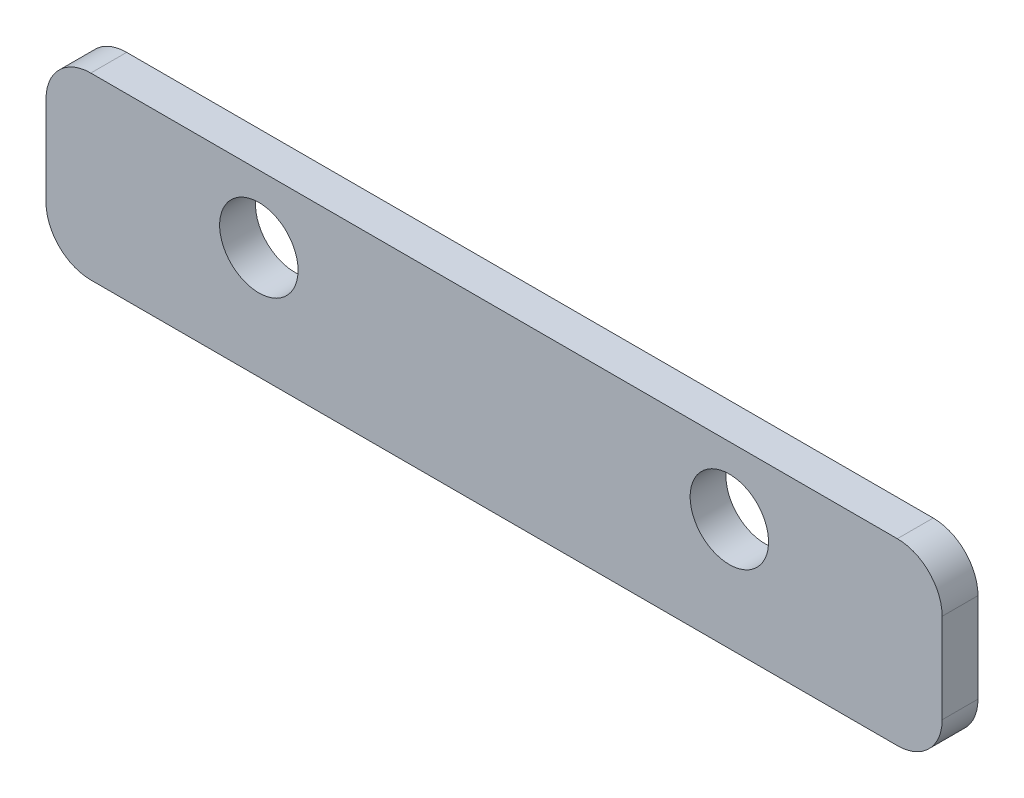
from build123d import *

# Parameters (mm, degrees)
SKETCH_1_R      = 1.75
EXTRUDE_1_DEPTH = 1.6


with BuildPart() as part:
    # Эскиз1 → Бобышка-Вытянуть1 (new body)
    with BuildSketch(Plane.XY):
        with BuildLine():
            Line((-18, -4), (18, -4))
            ThreePointArc((18, -4), (19.414213562, -3.414213562), (20, -2))
            Line((20, -2), (20, 2))
            ThreePointArc((20, 2), (19.414213562, 3.414213562), (18, 4))
            Line((18, 4), (-18, 4))
            ThreePointArc((-18, 4), (-19.414213562, 3.414213562), (-20, 2))
            Line((-20, 2), (-20, -2))
            ThreePointArc((-20, -2), (-19.414213562, -3.414213562), (-18, -4))
        make_face()
        with Locations((-10.5, 1)):
            Circle(SKETCH_1_R, mode=Mode.SUBTRACT)
        with Locations(Location((10.5, 1, 0), (0, 0, 180))):
            Circle(SKETCH_1_R, mode=Mode.SUBTRACT)
    extrude(amount=EXTRUDE_1_DEPTH)


solid = part.part
